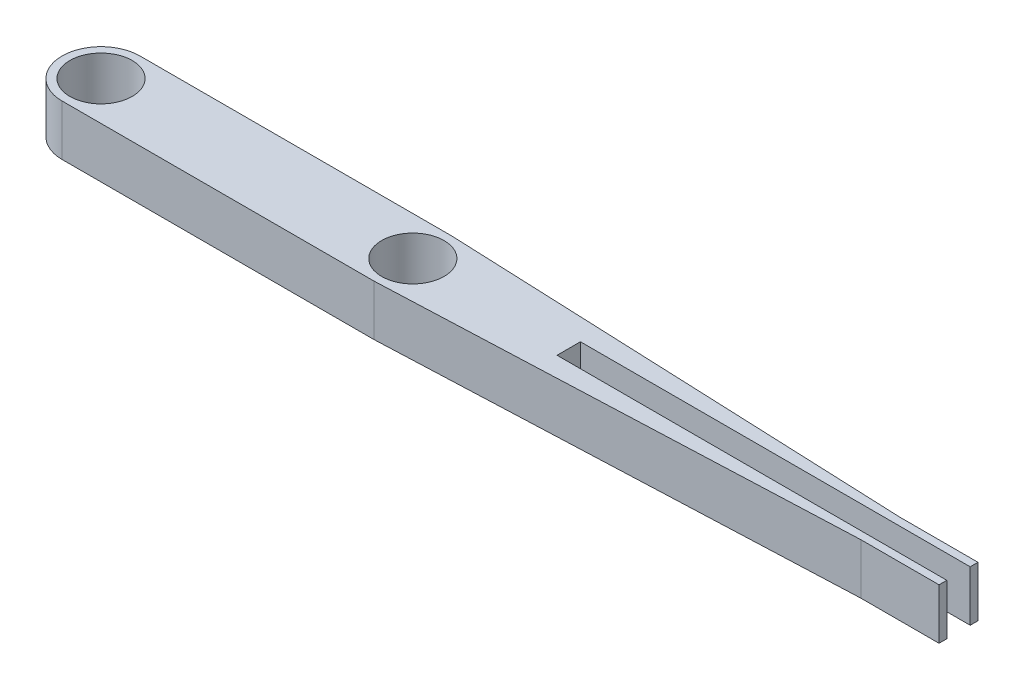
from build123d import *

# Parameters (mm, degrees)
SKETCH_1_R          = 4
EXTRUDE_1_DEPTH     = 6.5
SKETCH_2_W          = 40
SKETCH_2_H          = 3
CUT_EXTRUDE_1_DEPTH = 101.335686573
SKETCH_3_W          = 1
SKETCH_3_H          = 6.5
EXTRUDE_2_DEPTH     = 10


with BuildPart() as part:
    # 草图1 → 凸台-拉伸1 (new body)
    with BuildSketch(Plane(origin=(0, 0, 0), x_dir=(1, 0, 0), z_dir=(0, 1, 0))):
        with BuildLine():
            ThreePointArc((0, 5), (-5, 0), (0, -5))
            Line((0, -5), (40, -5))
            Line((40, -5), (100, -2.5))
            Line((100, -2.5), (100, 2.5))
            Line((100, 2.5), (40, 5))
            Line((40, 5), (0, 5))
        make_face()
        with Locations(Location((0, 0, 0), (0, 0, 90))):
            Circle(SKETCH_1_R, mode=Mode.SUBTRACT)
        with Locations(Location((40, 0, 0), (0, 0, 90))):
            Circle(SKETCH_1_R, mode=Mode.SUBTRACT)
    extrude(amount=EXTRUDE_1_DEPTH)

    # 草图2 → 切除-拉伸1 (cut, through all)
    with BuildSketch(Plane(origin=(0, 6.5, 0), x_dir=(1, 0, 0), z_dir=(0, 1, 0))):
        with Locations((80, 0)):
            Rectangle(SKETCH_2_W, SKETCH_2_H)
    extrude(amount=-CUT_EXTRUDE_1_DEPTH, mode=Mode.SUBTRACT)

    # 草图3 → 凸台-拉伸2 (add)
    with BuildSketch(Plane(origin=(100, 0, 0), x_dir=(0, 0, -1), z_dir=(1, 0, 0))):
        with Locations((-2, 3.25)):
            Rectangle(SKETCH_3_W, SKETCH_3_H)
        with Locations((2, 3.25)):
            Rectangle(SKETCH_3_W, SKETCH_3_H)
    extrude(amount=EXTRUDE_2_DEPTH)


solid = part.part
